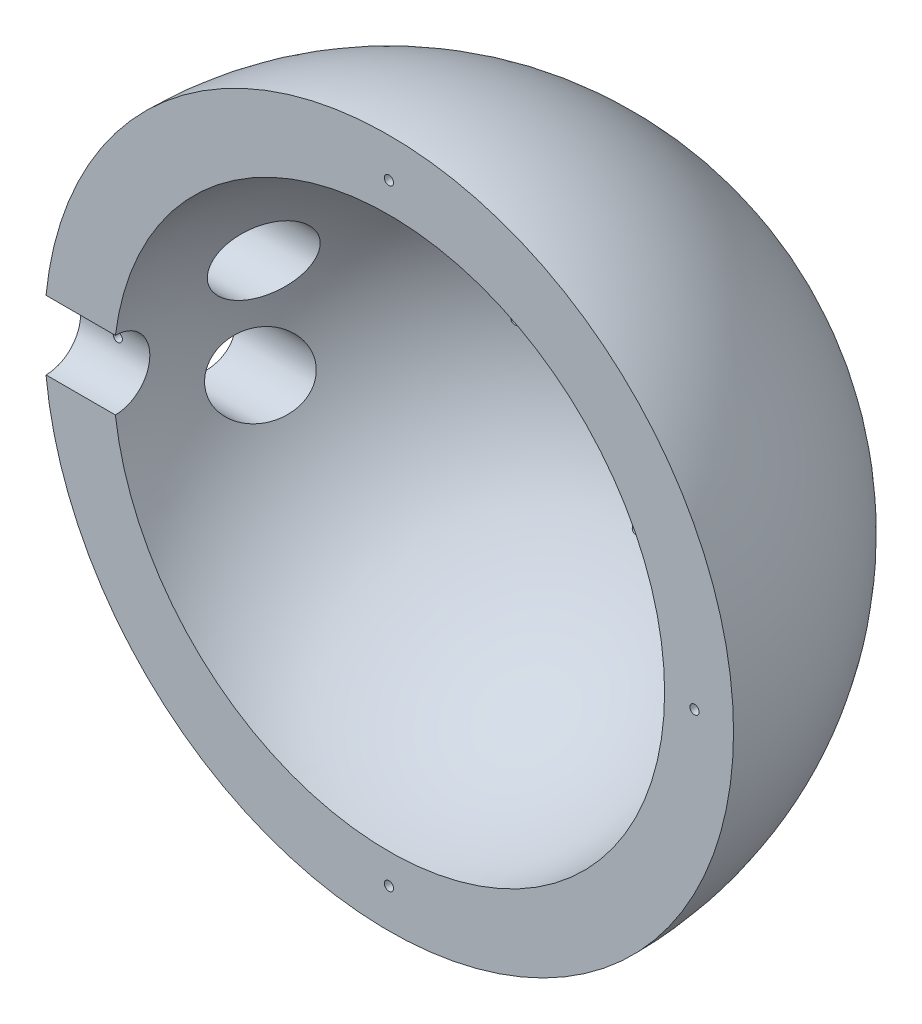
from build123d import *

# Parameters (mm, degrees)
REVOLU_O1_ANGLE            = 180
ESBO_O6_R                  = 20
CORTE_EXTRUS_O3_DEPTH      = 130.903810568
ESBO_O7_R                  = 7.5
CORTE_EXTRUS_O4_DEPTH      = 129.354976586
CORTE_EXTRUS_O5_DEPTH      = 50
CORTE_EXTRUS_O5_DEPTH_BACK = 44
ESBO_O8_W                  = 70
ESBO_O8_H                  = 12.551087697
ESBO_O9_R                  = 1
CORTE_EXTRUS_O6_DEPTH      = 126.312510747
SKETCH2_R                  = 8.2
CUT_EXTRUDE3_DEPTH         = 30
SKETCH4_R                  = 1
CUT_EXTRUDE4_DEPTH         = 20


with BuildPart() as part:
    # Esboço1 → Revolução1 (revolve)
    with BuildSketch(Plane.XY):
        with BuildLine():
            Line((-60, 0), (-75, 0))
            ThreePointArc((-75, 0), (0, 75), (75, 0))
            Line((75, 0), (60, 0))
            ThreePointArc((60, 0), (0, 60), (-60, 0))
        make_face()
    revolve(axis=Axis((-60, 0, 0), (-1, 0, 0)), revolution_arc=REVOLU_O1_ANGLE)

    # Esboço6 → Corte-extrusão3 (cut, through all)
    with BuildSketch(Plane.XY):
        Circle(ESBO_O6_R)
    extrude(amount=-CORTE_EXTRUS_O3_DEPTH, mode=Mode.SUBTRACT)

    # Esboço7 → Corte-extrusão4 (cut, through all)
    with BuildSketch(Plane(origin=(0, 0, 0), x_dir=(0, 0, -1), z_dir=(1, 0, 0))):
        Circle(ESBO_O7_R)
    extrude(amount=-CORTE_EXTRUS_O4_DEPTH, mode=Mode.SUBTRACT)

    # Esboço8 → Corte-extrusão5 (cut, two sides: drawn at the far end of the back side and taken through both)
    with BuildSketch(Plane(origin=(0, 0, 0), x_dir=(1, 0, 0), z_dir=(0, 1, 0)).offset(-CORTE_EXTRUS_O5_DEPTH_BACK)):
        with Locations((0, 73.008034748)):
            Rectangle(ESBO_O8_W, ESBO_O8_H)
    extrude(amount=CORTE_EXTRUS_O5_DEPTH + CORTE_EXTRUS_O5_DEPTH_BACK, mode=Mode.SUBTRACT)

    # Esboço9 → Corte-extrusão6 (cut, through all)
    with BuildSketch(Plane(origin=(0, 0, -66.7324909), x_dir=(-1, 0, 0), z_dir=(0, 0, -1))):
        with Locations((-26, 0)):
            Circle(ESBO_O9_R)
        with Locations((0, 26)):
            Circle(ESBO_O9_R)
        with Locations((26, 0)):
            Circle(ESBO_O9_R)
        with Locations((0, -26)):
            Circle(ESBO_O9_R)
    extrude(amount=-CORTE_EXTRUS_O6_DEPTH, mode=Mode.SUBTRACT)

    # Sketch2 → Cut-Extrude3 (cut)
    with BuildSketch(Plane(origin=(-74.624057783, 0, 0), x_dir=(0, 0, -1), z_dir=(1, 0, 0))):
        with Locations((25, -9.296175558)):
            Circle(SKETCH2_R)
        with Locations((25, 12.7)):
            Circle(SKETCH2_R)
    extrude(amount=CUT_EXTRUDE3_DEPTH, mode=Mode.SUBTRACT)

    # Sketch4 → Cut-Extrude4 (cut)
    with BuildSketch(Plane.XY.offset(10)):
        with Locations((66.5, 0)):
            Circle(SKETCH4_R)
        with Locations((0, -66.5)):
            Circle(SKETCH4_R)
        with Locations((-66.5, 0)):
            Circle(SKETCH4_R)
        with Locations((0, 66.5)):
            Circle(SKETCH4_R)
    extrude(amount=-CUT_EXTRUDE4_DEPTH, mode=Mode.SUBTRACT)


solid = part.part
